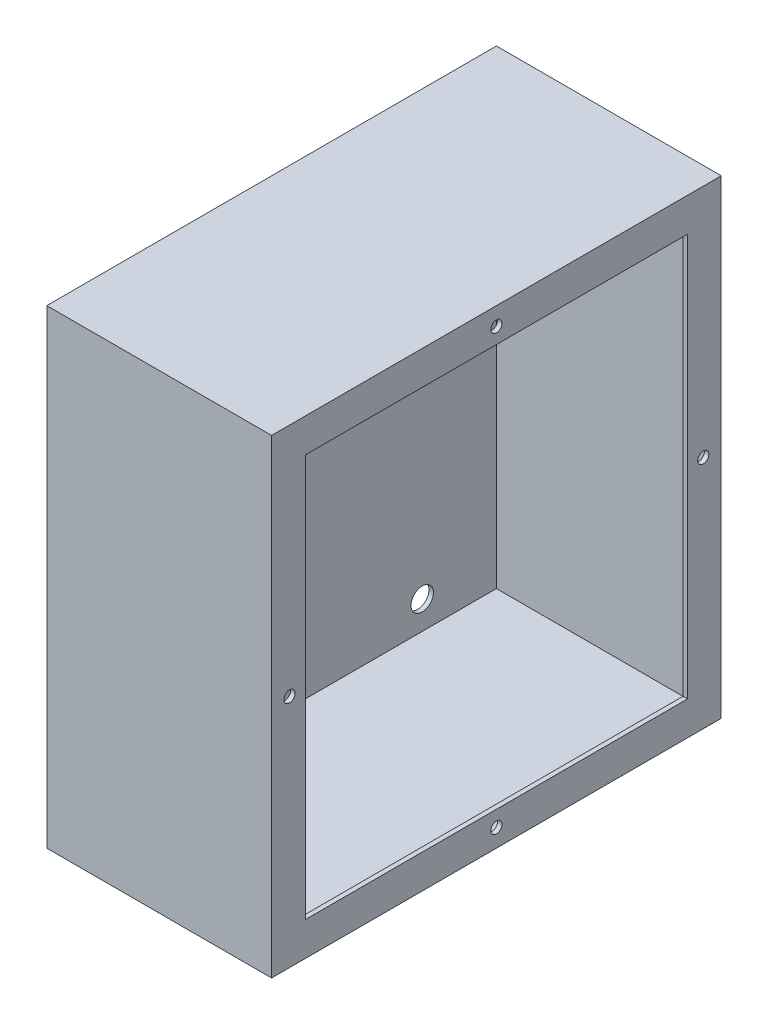
from build123d import *

# Parameters (mm, degrees)
SKETCH_1_W          = 200
SKETCH_1_H          = 209
EXTRUDE_1_DEPTH     = 100
SHELL_1_T           = 2
CUT_EXTRUDE_1_REACH = 177.842
SKETCH_2_W          = 170
SKETCH_2_H          = 179
CUT_EXTRUDE_2_REACH = 177.842
SKETCH_3_R          = 2.5
CUT_EXTRUDE_3_REACH = 177.842
SKETCH_4_R          = 5


with BuildPart() as part:
    # 草图1 → 凸台-拉伸1 (new body)
    with BuildSketch(Plane(origin=(0, 0, 0), x_dir=(0, 0, -1), z_dir=(1, 0, 0))):
        Rectangle(SKETCH_1_W, SKETCH_1_H)
    extrude(amount=EXTRUDE_1_DEPTH)

    # 抽壳1 (no face opened: a closed hollow body)
    add(offset(amount=-SHELL_1_T, mode=Mode.PRIVATE), mode=Mode.SUBTRACT)

    # 草图2 → 切除-拉伸1 (cut, up to next)
    with BuildSketch(Plane(origin=(100, 0, 0), x_dir=(0, 0, -1), z_dir=(1, 0, 0)), mode=Mode.PRIVATE) as cut_extrude_1_sk1:
        Rectangle(SKETCH_2_W, SKETCH_2_H)
    cut_extrude_1_tool1 = extrude(cut_extrude_1_sk1.sketch, amount=-CUT_EXTRUDE_1_REACH, mode=Mode.PRIVATE) & part.part
    add(cut_extrude_1_tool1.solids().sort_by_distance((100, 0, 0))[0], mode=Mode.SUBTRACT)

    # 草图3 → 切除-拉伸2 (cut, up to next)
    with BuildSketch(Plane(origin=(100, 0, 0), x_dir=(0, 0, -1), z_dir=(1, 0, 0)), mode=Mode.PRIVATE) as cut_extrude_2_sk1:
        with Locations((0, 96.5)):
            Circle(SKETCH_3_R)
    cut_extrude_2_tool1 = extrude(cut_extrude_2_sk1.sketch, amount=-CUT_EXTRUDE_2_REACH, mode=Mode.PRIVATE) & part.part
    # 草图3 → 切除-拉伸2 (cut, up to next)
    with BuildSketch(Plane(origin=(100, 0, 0), x_dir=(0, 0, -1), z_dir=(1, 0, 0)), mode=Mode.PRIVATE) as cut_extrude_2_sk2:
        with Locations((-92, 0)):
            Circle(SKETCH_3_R)
    cut_extrude_2_tool2 = extrude(cut_extrude_2_sk2.sketch, amount=-CUT_EXTRUDE_2_REACH, mode=Mode.PRIVATE) & part.part
    # 草图3 → 切除-拉伸2 (cut, up to next)
    with BuildSketch(Plane(origin=(100, 0, 0), x_dir=(0, 0, -1), z_dir=(1, 0, 0)), mode=Mode.PRIVATE) as cut_extrude_2_sk3:
        with Locations((0, -96.5)):
            Circle(SKETCH_3_R)
    cut_extrude_2_tool3 = extrude(cut_extrude_2_sk3.sketch, amount=-CUT_EXTRUDE_2_REACH, mode=Mode.PRIVATE) & part.part
    # 草图3 → 切除-拉伸2 (cut, up to next)
    with BuildSketch(Plane(origin=(100, 0, 0), x_dir=(0, 0, -1), z_dir=(1, 0, 0)), mode=Mode.PRIVATE) as cut_extrude_2_sk4:
        with Locations((92, 0)):
            Circle(SKETCH_3_R)
    cut_extrude_2_tool4 = extrude(cut_extrude_2_sk4.sketch, amount=-CUT_EXTRUDE_2_REACH, mode=Mode.PRIVATE) & part.part
    add(cut_extrude_2_tool1.solids().sort_by_distance((100, 96.5, 0))[0], mode=Mode.SUBTRACT)
    add(cut_extrude_2_tool2.solids().sort_by_distance((100, 0, 92))[0], mode=Mode.SUBTRACT)
    add(cut_extrude_2_tool3.solids().sort_by_distance((100, -96.5, 0))[0], mode=Mode.SUBTRACT)
    add(cut_extrude_2_tool4.solids().sort_by_distance((100, 0, -92))[0], mode=Mode.SUBTRACT)

    # 草图4 → 切除-拉伸3 (cut, up to next)
    with BuildSketch(Plane.ZY, mode=Mode.PRIVATE) as cut_extrude_3_sk1:
        with Locations((-65, 90)):
            Circle(SKETCH_4_R)
    cut_extrude_3_tool1 = extrude(cut_extrude_3_sk1.sketch, amount=-CUT_EXTRUDE_3_REACH, mode=Mode.PRIVATE) & part.part
    # 草图4 → 切除-拉伸3 (cut, up to next)
    with BuildSketch(Plane.ZY, mode=Mode.PRIVATE) as cut_extrude_3_sk2:
        with Locations(Location((65, 90, 0), (0, 0, 180))):
            Circle(SKETCH_4_R)
    cut_extrude_3_tool2 = extrude(cut_extrude_3_sk2.sketch, amount=-CUT_EXTRUDE_3_REACH, mode=Mode.PRIVATE) & part.part
    # 草图4 → 切除-拉伸3 (cut, up to next)
    with BuildSketch(Plane.ZY, mode=Mode.PRIVATE) as cut_extrude_3_sk3:
        with Locations(Location((-65, -90, 0), (0, 0, 180))):
            Circle(SKETCH_4_R)
    cut_extrude_3_tool3 = extrude(cut_extrude_3_sk3.sketch, amount=-CUT_EXTRUDE_3_REACH, mode=Mode.PRIVATE) & part.part
    # 草图4 → 切除-拉伸3 (cut, up to next)
    with BuildSketch(Plane.ZY, mode=Mode.PRIVATE) as cut_extrude_3_sk4:
        with Locations((65, -90)):
            Circle(SKETCH_4_R)
    cut_extrude_3_tool4 = extrude(cut_extrude_3_sk4.sketch, amount=-CUT_EXTRUDE_3_REACH, mode=Mode.PRIVATE) & part.part
    add(cut_extrude_3_tool1.solids().sort_by_distance((0, 90, -65))[0], mode=Mode.SUBTRACT)
    add(cut_extrude_3_tool2.solids().sort_by_distance((0, 90, 65))[0], mode=Mode.SUBTRACT)
    add(cut_extrude_3_tool3.solids().sort_by_distance((0, -90, -65))[0], mode=Mode.SUBTRACT)
    add(cut_extrude_3_tool4.solids().sort_by_distance((0, -90, 65))[0], mode=Mode.SUBTRACT)


solid = part.part
